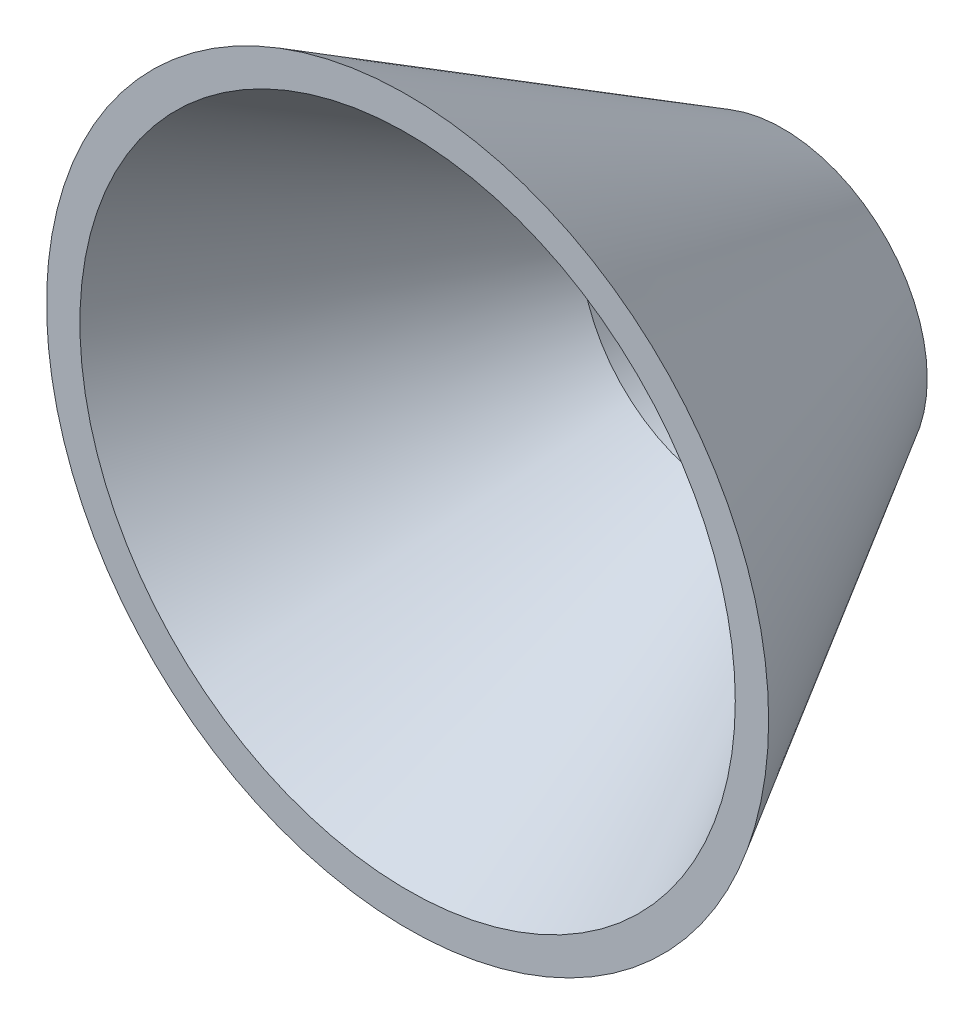
from build123d import *

# Parameters (mm, degrees)
WANDUNG1_T                           = -2
SCHNITT_LINEAR_AUSTRAGEN1_DEPTH      = 56.901699437
SCHNITT_LINEAR_AUSTRAGEN1_DEPTH_BACK = 56.901699437
SKIZZE3_R                            = 10


with BuildPart() as part:
    # Aufsatz-Linear austragen1 cone 1 section (through the dimple's axis) → Aufsatz-Linear austragen1 (revolve)
    with BuildSketch(Plane(origin=(0, 0, 0), x_dir=(0, -1, 0), z_dir=(1, 0, 0))):
        Polygon((0, 0), (25, 0), (0, 43.301270189), align=None)
    revolve(axis=Axis((0, 0, 0), (0, 0, -1)))

    # Wandung1
    wandung1_openings = [part.faces().sort_by_distance(p)[0] for p in [
        (0, 0, 0),
    ]]
    offset(amount=WANDUNG1_T, openings=wandung1_openings, kind=Kind.INTERSECTION)

    # Skizze3 → Schnitt-Linear austragen1 (cut, two sides: drawn at the far end of the back side and taken through both)
    with BuildSketch(Plane.XY.offset(-SCHNITT_LINEAR_AUSTRAGEN1_DEPTH_BACK)):
        Circle(SKIZZE3_R)
    extrude(amount=SCHNITT_LINEAR_AUSTRAGEN1_DEPTH + SCHNITT_LINEAR_AUSTRAGEN1_DEPTH_BACK, mode=Mode.SUBTRACT)


solid = part.part
